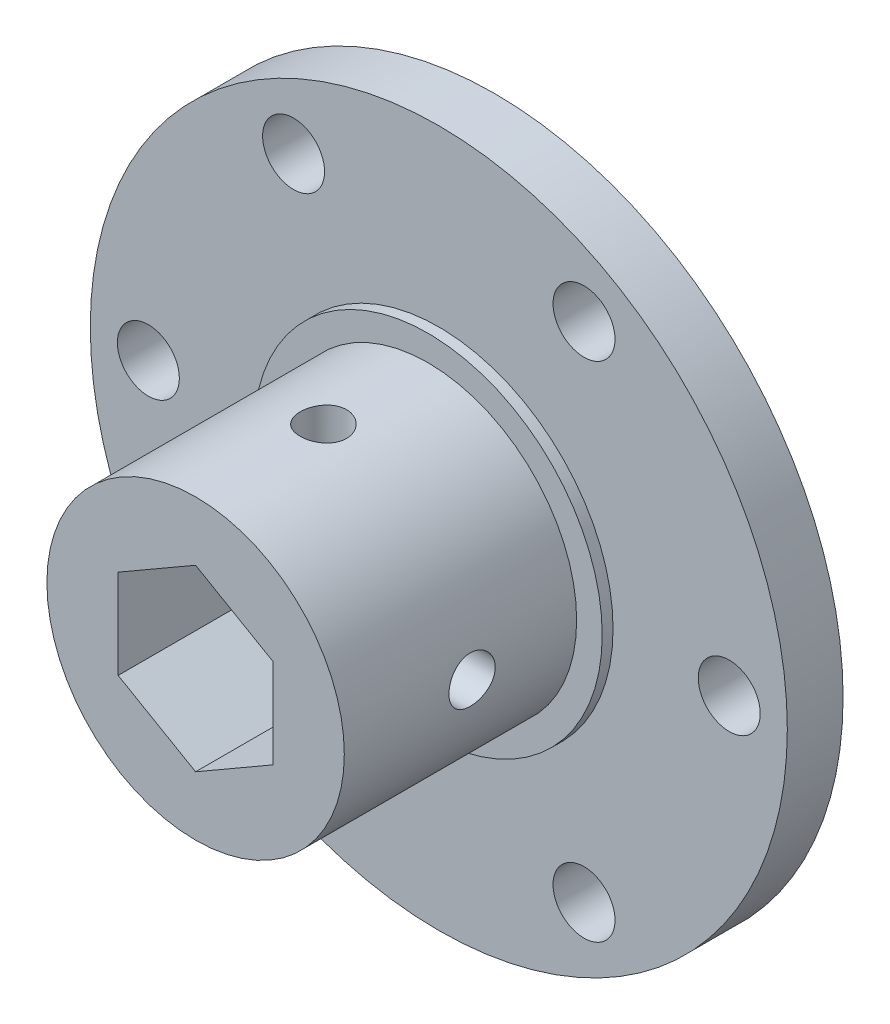
from build123d import *

# Parameters (mm, degrees)
SKETCH1_R              = 14.2875
BOSS_EXTRUDE1_DEPTH    = 0.889
SKETCH2_R              = 28.575
BOSS_EXTRUDE2_DEPTH    = 4.572
SKETCH3_R              = 14.2875
BOSS_EXTRUDE3_DEPTH    = 0.889
SKETCH4_R              = 12.192
BOSS_EXTRUDE4_DEPTH    = 19.05
SKETCH5_R              = 2.54
CUT_EXTRUDE1_DEPTH     = 48.2636263
CUT_EXTRUDE2_DEPTH     = 48.730716001
F_10_24_TAPPED_HOLE1_D = 3.7973
CIRPATTERN1_COUNT      = 2
CIRPATTERN1_ANGLE      = 90


with BuildPart() as part:
    # Sketch1 → Boss-Extrude1 (new body)
    with BuildSketch(Plane.XY):
        Circle(SKETCH1_R)
    extrude(amount=BOSS_EXTRUDE1_DEPTH)

    # Sketch2 → Boss-Extrude2 (add)
    with BuildSketch(Plane.XY.offset(0.889)):
        Circle(SKETCH2_R)
    extrude(amount=BOSS_EXTRUDE2_DEPTH)

    # Sketch3 → Boss-Extrude3 (add)
    with BuildSketch(Plane.XY.offset(5.461)):
        Circle(SKETCH3_R)
    extrude(amount=BOSS_EXTRUDE3_DEPTH)

    # Sketch4 → Boss-Extrude4 (add)
    with BuildSketch(Plane.XY.offset(6.35)):
        with Locations(Location((0, 0, 0), (0, 0, 180))):
            Circle(SKETCH4_R)
    extrude(amount=BOSS_EXTRUDE4_DEPTH)

    # Sketch5 → Cut-Extrude1 (cut, through all)
    with BuildSketch(Plane(origin=(0, 0, 0.889), x_dir=(-1, 0, 0), z_dir=(0, 0, -1))):
        with Locations((-11.90625, 20.622229928)):
            Circle(SKETCH5_R)
        with Locations((11.90625, 20.622229928)):
            Circle(SKETCH5_R)
        with Locations((23.8125, 0)):
            Circle(SKETCH5_R)
        with Locations((11.90625, -20.622229928)):
            Circle(SKETCH5_R)
        with Locations((-11.90625, -20.622229928)):
            Circle(SKETCH5_R)
        with Locations((-23.8125, 0)):
            Circle(SKETCH5_R)
    extrude(amount=-CUT_EXTRUDE1_DEPTH, mode=Mode.SUBTRACT)

    # Sketch6 → Cut-Extrude2 (cut, through all)
    with BuildSketch(Plane.XY.offset(25.4)):
        Polygon((0, 7.332348419), (-6.35, 3.666174209), (-6.35, -3.666174209), (0, -7.332348419), (6.35, -3.666174209), (6.35, 3.666174209), align=None)
    extrude(amount=-CUT_EXTRUDE2_DEPTH, mode=Mode.SUBTRACT)

    # #10-24 Tapped Hole1 (through all)
    with Locations(Plane(origin=(12.192, 0, 14.9225), x_dir=(0, 0, 1), z_dir=(1, 0, 0))):
        with Locations((0, 0)):
            f_10_24_tapped_hole1 = Hole(F_10_24_TAPPED_HOLE1_D / 2)

    # CirPattern1: #10-24 Tapped Hole1 ×2 about axis
    cirpattern1_axis = Axis((0, 0, 5.461), (0, 0, 1))
    for i in range(1, CIRPATTERN1_COUNT):
        add(f_10_24_tapped_hole1.rotate(cirpattern1_axis, i * CIRPATTERN1_ANGLE / (CIRPATTERN1_COUNT - 1)), mode=Mode.SUBTRACT)


solid = part.part
